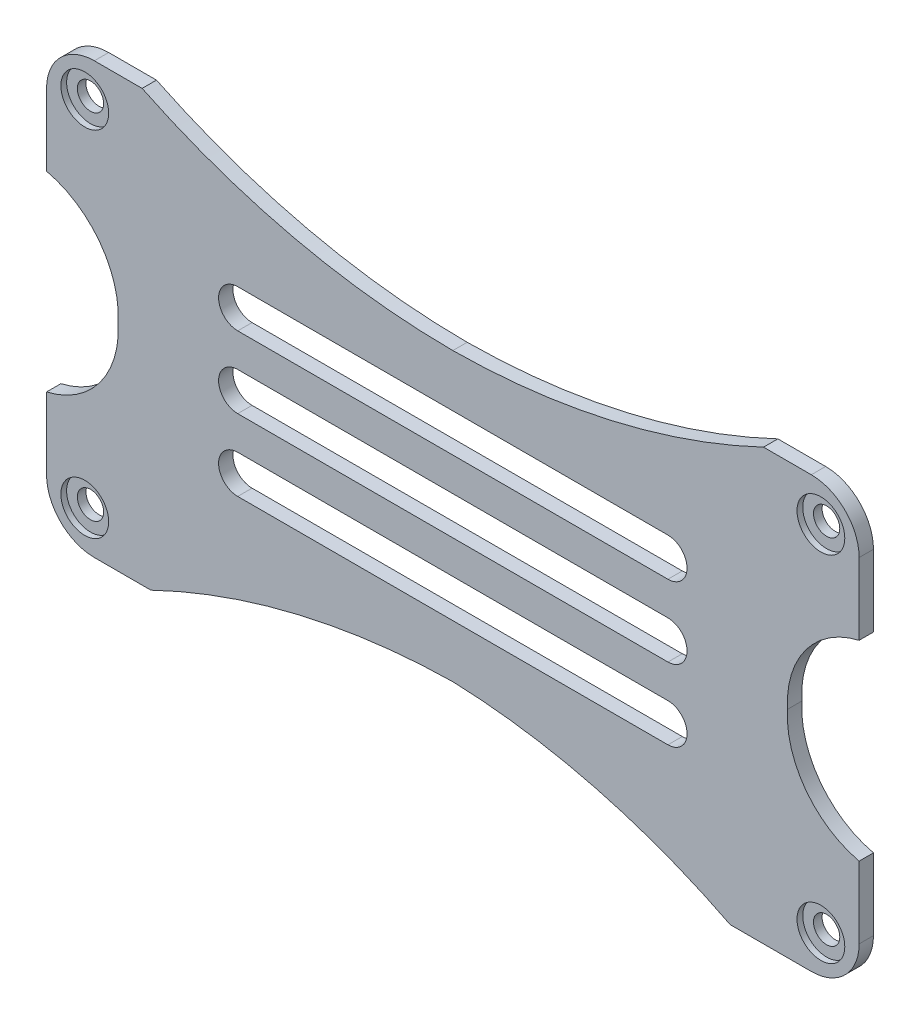
from build123d import *

# Parameters (mm, degrees)
EXTRUDE_1_DEPTH          = 3
CUT_EXTRUDE_1_DEPTH      = 42
CUT_EXTRUDE_1_DEPTH_BACK = 10
SKETCH_2_R               = 2.75
SKETCH_3_R               = 5
CUT_EXTRUDE_2_DEPTH      = 1.2


with BuildPart() as part:
    # 草图1 → 凸台-拉伸1 (new body)
    with BuildSketch(Plane.XY):
        with BuildLine():
            Line((-72.574116531, 45.487390308), (77.425883469, 45.487390308))
            ThreePointArc((77.425883469, 45.487390308), (84.496951281, 42.558458119), (87.425883469, 35.487390308))
            Line((87.425883469, 35.487390308), (87.425883469, -34.512609692))
            ThreePointArc((87.425883469, -34.512609692), (84.496951281, -41.583677504), (77.425883469, -44.512609692))
            Line((77.425883469, -44.512609692), (-72.574116531, -44.512609692))
            ThreePointArc((-72.574116531, -44.512609692), (-79.645184343, -41.583677504), (-82.574116531, -34.512609692))
            Line((-82.574116531, -34.512609692), (-82.574116531, 35.487390308))
            ThreePointArc((-82.574116531, 35.487390308), (-79.645184343, 42.558458119), (-72.574116531, 45.487390308))
        make_face()
    extrude(amount=EXTRUDE_1_DEPTH)

    # 草图2 → 切除-拉伸1 (cut, two sides: drawn at the far end of the back side and taken through both)
    with BuildSketch(Plane.XY.offset(3).offset(-CUT_EXTRUDE_1_DEPTH_BACK)):
        with Locations((-74.574116531, 37.487390308)):
            Circle(SKETCH_2_R)
        with Locations((-74.574116531, -36.512609692)):
            Circle(SKETCH_2_R)
        with Locations((79.425883469, 37.487390308)):
            Circle(SKETCH_2_R)
        with Locations((79.425883469, -36.512609692)):
            Circle(SKETCH_2_R)
        with BuildLine():
            Line((-60.749662301, -44.512609692), (60.437772164, -44.512609692))
            ThreePointArc((60.437772164, -44.512609692), (32.253211404, -33.835942142), (2.425883469, -29.512609692))
            ThreePointArc((2.425883469, -29.512609692), (-29.983273004, -33.55318593), (-60.749662301, -44.512609692))
        make_face()
        with BuildLine():
            Line((-62.574116531, 45.487390308), (67.425883469, 45.487390308))
            ThreePointArc((67.425883469, 45.487390308), (35.747267057, 34.428061428), (2.425883469, 30.487390308))
            ThreePointArc((2.425883469, 30.487390308), (-30.918540876, 34.328218147), (-62.574116531, 45.487390308))
        make_face()
        with BuildLine():
            Line((87.425883469, 20.487390308), (87.425883469, -19.512609692))
            ThreePointArc((87.425883469, -19.512609692), (76.286181126, -12.242386449), (72.425883469, 0.487390308))
            ThreePointArc((72.425883469, 0.487390308), (76.286181126, 13.217167065), (87.425883469, 20.487390308))
        make_face()
        with BuildLine():
            Line((-82.574116531, 20.487390308), (-82.574116531, -19.512609692))
            ThreePointArc((-82.574116531, -19.512609692), (-71.434414188, -12.242386449), (-67.574116531, 0.487390308))
            ThreePointArc((-67.574116531, 0.487390308), (-71.434414188, 13.217167065), (-82.574116531, 20.487390308))
        make_face()
        with BuildLine():
            Line((-42.574116531, 19.557096341), (47.425883469, 19.557096341))
            ThreePointArc((47.425883469, 19.557096341), (51.425883469, 15.557096341), (47.425883469, 11.557096341))
            Line((47.425883469, 11.557096341), (-42.574116531, 11.557096341))
            ThreePointArc((-42.574116531, 11.557096341), (-46.574116531, 15.557096341), (-42.574116531, 19.557096341))
        make_face()
        with BuildLine():
            Line((-42.574116531, 4.557096341), (47.425883469, 4.557096341))
            ThreePointArc((47.425883469, 4.557096341), (51.425883469, 0.557096341), (47.425883469, -3.442903659))
            Line((47.425883469, -3.442903659), (-42.574116531, -3.442903659))
            ThreePointArc((-42.574116531, -3.442903659), (-46.574116531, 0.557096341), (-42.574116531, 4.557096341))
        make_face()
        with BuildLine():
            Line((-42.574116531, -10.442903659), (47.425883469, -10.442903659))
            ThreePointArc((47.425883469, -10.442903659), (51.425883469, -14.442903659), (47.425883469, -18.442903659))
            Line((47.425883469, -18.442903659), (-42.574116531, -18.442903659))
            ThreePointArc((-42.574116531, -18.442903659), (-46.574116531, -14.442903659), (-42.574116531, -10.442903659))
        make_face()
    extrude(amount=CUT_EXTRUDE_1_DEPTH + CUT_EXTRUDE_1_DEPTH_BACK, mode=Mode.SUBTRACT)

    # 草图3 → 切除-拉伸2 (cut)
    with BuildSketch(Plane.XY.offset(3)):
        with Locations((-74.574116531, 37.487390308)):
            Circle(SKETCH_3_R)
        with Locations((79.425883469, 37.487390308)):
            Circle(SKETCH_3_R)
        with Locations((79.425883469, -36.512609692)):
            Circle(SKETCH_3_R)
        with Locations((-74.574116531, -36.512609692)):
            Circle(SKETCH_3_R)
    extrude(amount=-CUT_EXTRUDE_2_DEPTH, mode=Mode.SUBTRACT)


solid = part.part
